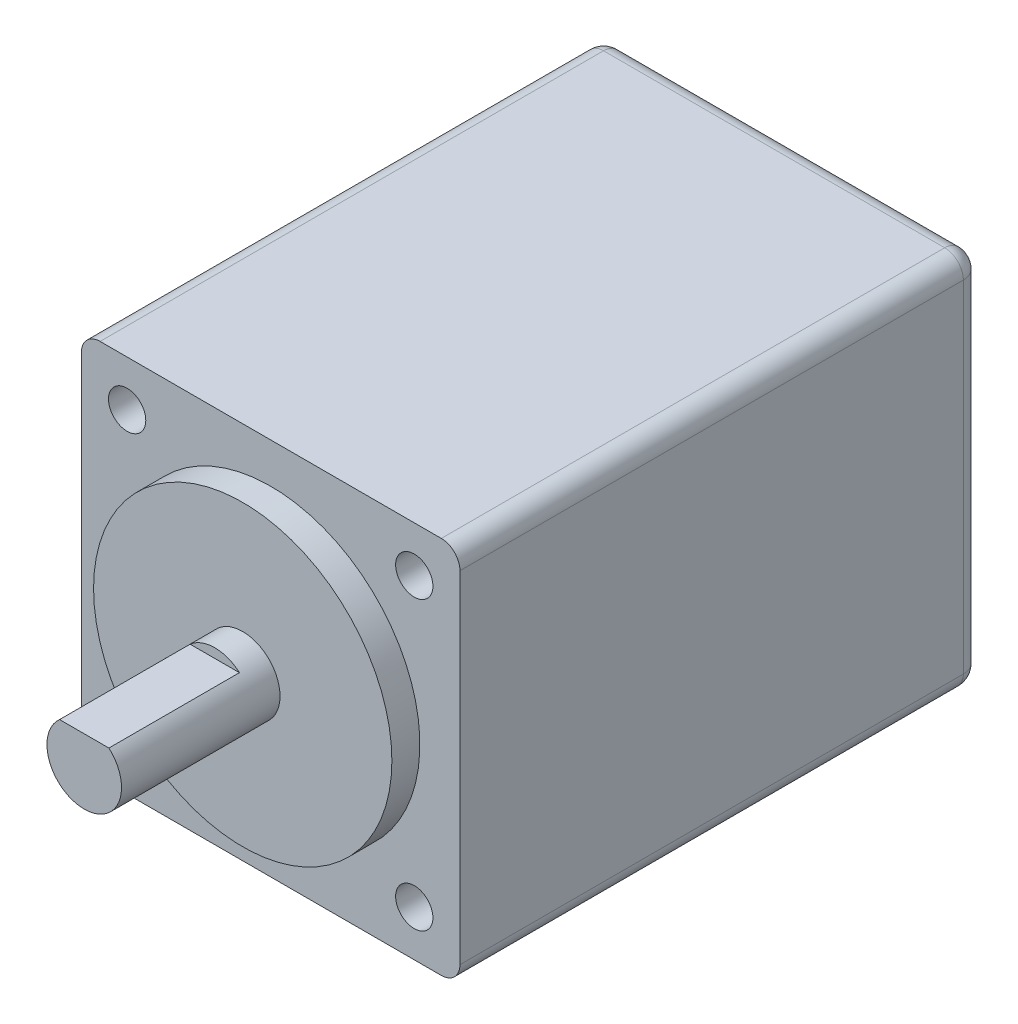
from build123d import *

# Parameters (mm, degrees)
SKETCH1_W           = 20.3
SKETCH1_H           = 20.3
BOSS_EXTRUDE1_DEPTH = 28
SKETCH2_R           = 8
BOSS_EXTRUDE2_DEPTH = 1.5
SKETCH3_R           = 2
BOSS_EXTRUDE3_DEPTH = 8.5
SKETCH4_W           = 7
SKETCH4_H           = 0.5
CUT_EXTRUDE1_DEPTH  = 5
SKETCH5_R           = 1
CUT_EXTRUDE2_DEPTH  = 2.5
FILLET1_R           = 1


with BuildPart() as part:
    # Sketch1 → Boss-Extrude1 (new body)
    with BuildSketch(Plane.XY):
        Rectangle(SKETCH1_W, SKETCH1_H)
    extrude(amount=BOSS_EXTRUDE1_DEPTH)

    # Sketch2 → Boss-Extrude2 (add)
    with BuildSketch(Plane.XY.offset(28)):
        with Locations(Location((0, 0, 0), (0, 0, 180))):
            Circle(SKETCH2_R)
    extrude(amount=BOSS_EXTRUDE2_DEPTH)

    # Sketch3 → Boss-Extrude3 (add)
    with BuildSketch(Plane.XY.offset(29.5)):
        Circle(SKETCH3_R)
    extrude(amount=BOSS_EXTRUDE3_DEPTH)

    # Sketch4 → Cut-Extrude1 (cut, symmetric)
    with BuildSketch(Plane(origin=(0, 0, 0), x_dir=(0, 0, -1), z_dir=(1, 0, 0))):
        with Locations((-34.5, 1.75)):
            Rectangle(SKETCH4_W, SKETCH4_H)
    extrude(amount=CUT_EXTRUDE1_DEPTH, both=True, mode=Mode.SUBTRACT)

    # Sketch5 → Cut-Extrude2 (cut)
    with BuildSketch(Plane.XY.offset(28)):
        with Locations((-7.7, 7.7)):
            Circle(SKETCH5_R)
        with Locations((7.7, 7.7)):
            Circle(SKETCH5_R)
        with Locations((7.7, -7.7)):
            Circle(SKETCH5_R)
        with Locations((-7.7, -7.7)):
            Circle(SKETCH5_R)
    extrude(amount=-CUT_EXTRUDE2_DEPTH, mode=Mode.SUBTRACT)

    # Fillet1
    fillet1_edges = [part.edges().sort_by_distance(p)[0] for p in [
        (0, -10.15, 0),
        (-10.15, 0, 0),
        (0, 10.15, 0),
        (10.15, 0, 0),
        (10.15, -10.15, 14),
        (-10.15, -10.15, 14),
        (-10.15, 10.15, 14),
        (10.15, 10.15, 14),
    ]]
    fillet(fillet1_edges, radius=FILLET1_R)


solid = part.part
